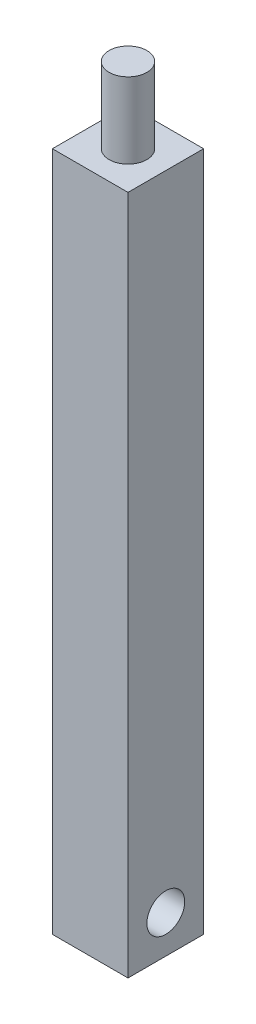
from build123d import *

# Parameters (mm, degrees)
SKETCH1_W           = 10
SKETCH1_H           = 10
BOSS_EXTRUDE1_DEPTH = 90
SKETCH2_R           = 2.5
BOSS_EXTRUDE2_DEPTH = 10
SKETCH3_R           = 2.5
CUT_EXTRUDE1_DEPTH  = 101.623058987


with BuildPart() as part:
    # Sketch1 → Boss-Extrude1 (new body)
    with BuildSketch(Plane(origin=(0, 0, 0), x_dir=(1, 0, 0), z_dir=(0, 1, 0))):
        Rectangle(SKETCH1_W, SKETCH1_H)
    extrude(amount=BOSS_EXTRUDE1_DEPTH)

    # Sketch2 → Boss-Extrude2 (add)
    with BuildSketch(Plane(origin=(0, 90, 0), x_dir=(1, 0, 0), z_dir=(0, 1, 0))):
        with Locations(Location((0, 0, 0), (0, 0, 270))):
            Circle(SKETCH2_R)
    extrude(amount=BOSS_EXTRUDE2_DEPTH)

    # Sketch3 → Cut-Extrude1 (cut, through all)
    with BuildSketch(Plane(origin=(5, 0, 0), x_dir=(0, 0, -1), z_dir=(1, 0, 0))):
        with Locations((0, 5)):
            Circle(SKETCH3_R)
    extrude(amount=-CUT_EXTRUDE1_DEPTH, mode=Mode.SUBTRACT)


solid = part.part
